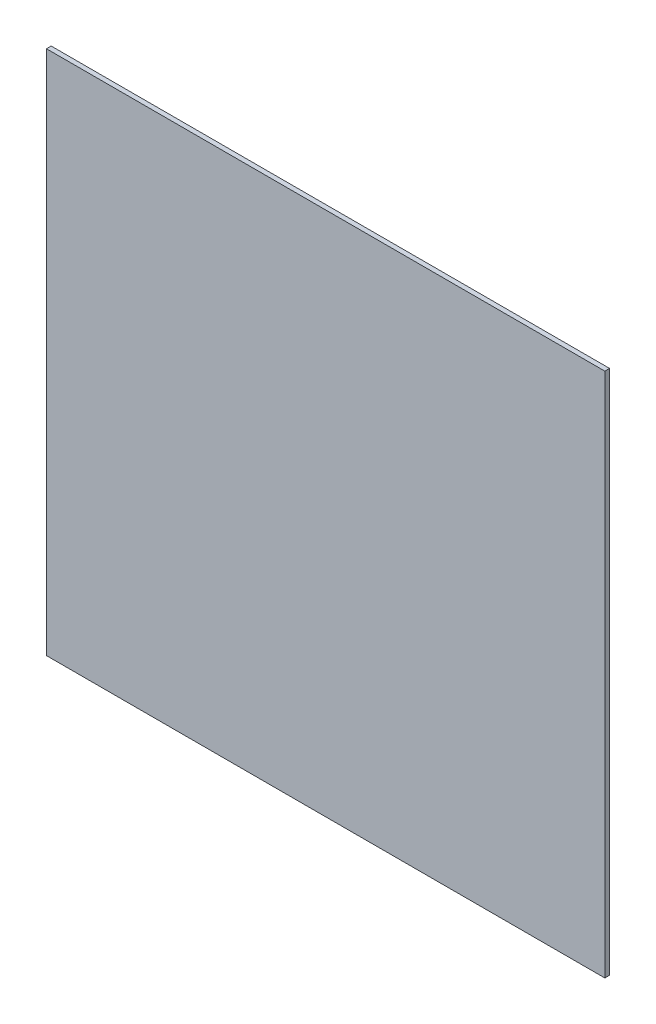
from build123d import *

# Parameters (mm, degrees)
SKETCH1_W           = 150
SKETCH1_H           = 141.19
BOSS_EXTRUDE1_DEPTH = 1.27


with BuildPart() as part:
    # Sketch1 → Boss-Extrude1 (new body)
    with BuildSketch(Plane.XY):
        with Locations((75, 70.595)):
            Rectangle(SKETCH1_W, SKETCH1_H)
    extrude(amount=BOSS_EXTRUDE1_DEPTH)


solid = part.part
